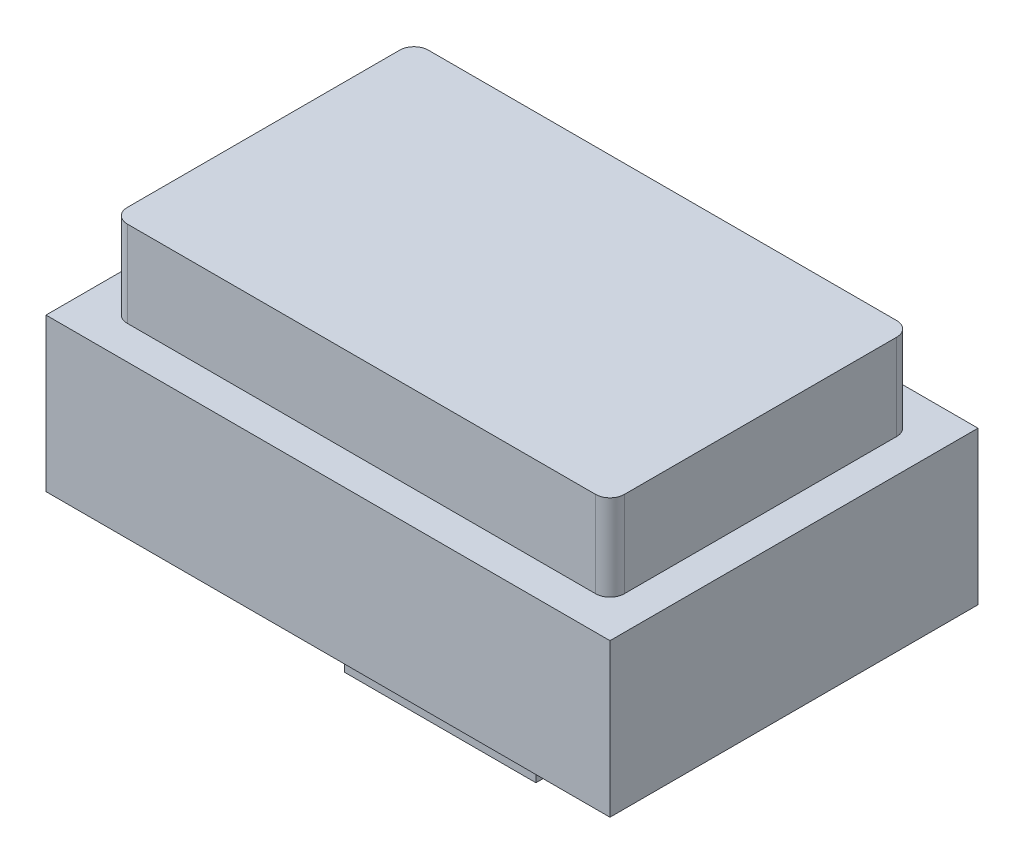
from build123d import *

# Parameters (mm, degrees)
BODY_S_W      = 10.4
BODY_S_H      = 6.3
BODY_DEPTH    = 1.8
EDGE_FILLET_R = 0.3
BASE_S_W      = 11.8
BASE_S_H      = 7.7
BASE_DEPTH    = 3.2
PEG_S_W       = 4
PEG_S_H       = 3
PEG_DEPTH     = 2.5


with BuildPart() as part:
    # body-s → body (new body)
    with BuildSketch(Plane(origin=(0, 0, 0), x_dir=(1, 0, 0), z_dir=(0, 1, 0))):
        Rectangle(BODY_S_W, BODY_S_H)
    extrude(amount=BODY_DEPTH)

    # edge-fillet
    edge_fillet_edges = [part.edges().sort_by_distance(p)[0] for p in [
        (5.2, 0.9, 3.15),
        (-5.2, 0.9, 3.15),
        (-5.2, 0.9, -3.15),
        (5.2, 0.9, -3.15),
    ]]
    fillet(edge_fillet_edges, radius=EDGE_FILLET_R)

    # base-s → base (add)
    with BuildSketch(Plane.XZ):
        Rectangle(BASE_S_W, BASE_S_H)
    extrude(amount=BASE_DEPTH)

    # peg-s → peg (add)
    with BuildSketch(Plane.XZ.offset(3.2)):
        Rectangle(PEG_S_W, PEG_S_H)
    extrude(amount=PEG_DEPTH)


solid = part.part
